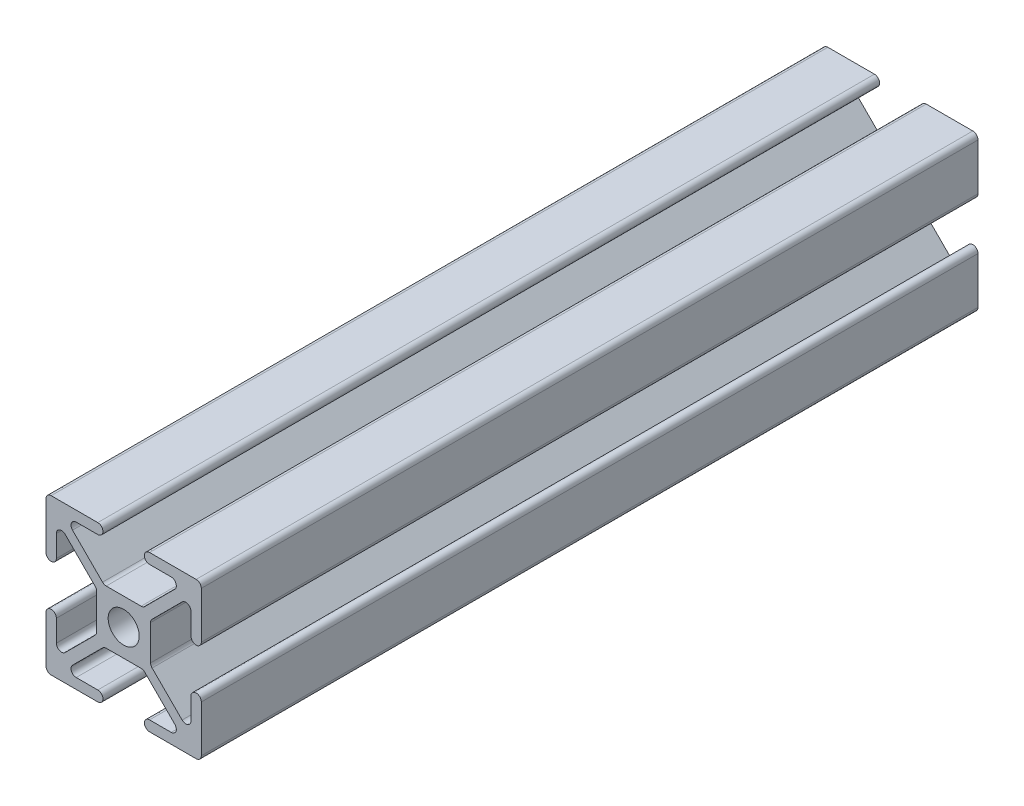
from build123d import *

# Parameters (mm, degrees)
SALIENTE_EXTRUIR1_DEPTH = 150
CROQUIS2_R              = 3
CORTAR_EXTRUIR1_DEPTH   = 152.492574075
CORTAR_EXTRUIR3_DEPTH   = 152.492574075


with BuildPart() as part:
    # Croquis1 → Saliente-Extruir1 (new body)
    with BuildSketch(Plane.XY):
        with BuildLine():
            Line((-14, 15), (14, 15))
            ThreePointArc((14, 15), (14.707106781, 14.707106781), (15, 14))
            Line((15, 14), (15, -14))
            ThreePointArc((15, -14), (14.707106781, -14.707106781), (14, -15))
            Line((14, -15), (-14, -15))
            ThreePointArc((-14, -15), (-14.707106781, -14.707106781), (-15, -14))
            Line((-15, -14), (-15, 14))
            ThreePointArc((-15, 14), (-14.707106781, 14.707106781), (-14, 15))
        make_face()
    extrude(amount=-SALIENTE_EXTRUIR1_DEPTH)

    # Croquis2 → Cortar-Extruir1 (cut, through all)
    with BuildSketch(Plane.XY):
        Circle(CROQUIS2_R)
    extrude(amount=-CORTAR_EXTRUIR1_DEPTH, mode=Mode.SUBTRACT)

    # Croquis3 → Cortar-Extruir3 (cut, through all)
    with BuildSketch(Plane.XY):
        with BuildLine():
            Line((-5.492893219, 4.078679656), (-11.292893219, 9.878679656))
            ThreePointArc((-11.292893219, 9.878679656), (-12.382683432, 10.095452408), (-13, 9.171572875))
            Line((-13, 9.171572875), (-13, 5))
            ThreePointArc((-13, 5), (-14, 4), (-15, 5))
            Line((-15, 5), (-15, -5))
            ThreePointArc((-15, -5), (-14, -4), (-13, -5))
            Line((-13, -5), (-13, -9.171572875))
            ThreePointArc((-13, -9.171572875), (-12.382683432, -10.095452408), (-11.292893219, -9.878679656))
            Line((-11.292893219, -9.878679656), (-5.492893219, -4.078679656))
            ThreePointArc((-5.492893219, -4.078679656), (-5.276120467, -3.754256308), (-5.2, -3.371572875))
            Line((-5.2, -3.371572875), (-5.2, 3.371572875))
            ThreePointArc((-5.2, 3.371572875), (-5.276120467, 3.754256308), (-5.492893219, 4.078679656))
        make_face()
        with BuildLine():
            ThreePointArc((-9.171572875, 13), (-10.095452408, 12.382683432), (-9.878679656, 11.292893219))
            Line((-9.878679656, 11.292893219), (-4.078679656, 5.492893219))
            ThreePointArc((-4.078679656, 5.492893219), (-3.754256308, 5.276120467), (-3.371572875, 5.2))
            Line((-3.371572875, 5.2), (3.371572875, 5.2))
            ThreePointArc((3.371572875, 5.2), (3.754256308, 5.276120467), (4.078679656, 5.492893219))
            Line((4.078679656, 5.492893219), (9.878679656, 11.292893219))
            ThreePointArc((9.878679656, 11.292893219), (10.095452408, 12.382683432), (9.171572875, 13))
            Line((9.171572875, 13), (5, 13))
            ThreePointArc((5, 13), (4, 14), (5, 15))
            Line((5, 15), (-5, 15))
            ThreePointArc((-5, 15), (-4.292893219, 14.707106781), (-4, 14))
            ThreePointArc((-4, 14), (-4.292893219, 13.292893219), (-5, 13))
            Line((-5, 13), (-9.171572875, 13))
        make_face()
        with BuildLine():
            Line((9.878679656, -11.292893219), (4.078679656, -5.492893219))
            ThreePointArc((4.078679656, -5.492893219), (3.754256308, -5.276120467), (3.371572875, -5.2))
            Line((3.371572875, -5.2), (-3.371572875, -5.2))
            ThreePointArc((-3.371572875, -5.2), (-3.754256308, -5.276120467), (-4.078679656, -5.492893219))
            Line((-4.078679656, -5.492893219), (-9.878679656, -11.292893219))
            ThreePointArc((-9.878679656, -11.292893219), (-10.095452408, -12.382683432), (-9.171572875, -13))
            Line((-9.171572875, -13), (-5, -13))
            ThreePointArc((-5, -13), (-4.292893219, -13.292893219), (-4, -14))
            ThreePointArc((-4, -14), (-4.292893219, -14.707106781), (-5, -15))
            Line((-5, -15), (5, -15))
            ThreePointArc((5, -15), (4, -14), (5, -13))
            Line((5, -13), (9.171572875, -13))
            ThreePointArc((9.171572875, -13), (10.095452408, -12.382683432), (9.878679656, -11.292893219))
        make_face()
        with BuildLine():
            ThreePointArc((13, 9.171572875), (12.382683432, 10.095452408), (11.292893219, 9.878679656))
            Line((11.292893219, 9.878679656), (5.492893219, 4.078679656))
            ThreePointArc((5.492893219, 4.078679656), (5.276120467, 3.754256308), (5.2, 3.371572875))
            Line((5.2, 3.371572875), (5.2, -3.371572875))
            ThreePointArc((5.2, -3.371572875), (5.276120467, -3.754256308), (5.492893219, -4.078679656))
            Line((5.492893219, -4.078679656), (11.292893219, -9.878679656))
            ThreePointArc((11.292893219, -9.878679656), (12.382683432, -10.095452408), (13, -9.171572875))
            Line((13, -9.171572875), (13, -5))
            ThreePointArc((13, -5), (14, -4), (15, -5))
            Line((15, -5), (15, 5))
            ThreePointArc((15, 5), (14, 4), (13, 5))
            Line((13, 5), (13, 9.171572875))
        make_face()
    extrude(amount=-CORTAR_EXTRUIR3_DEPTH, mode=Mode.SUBTRACT)


solid = part.part
